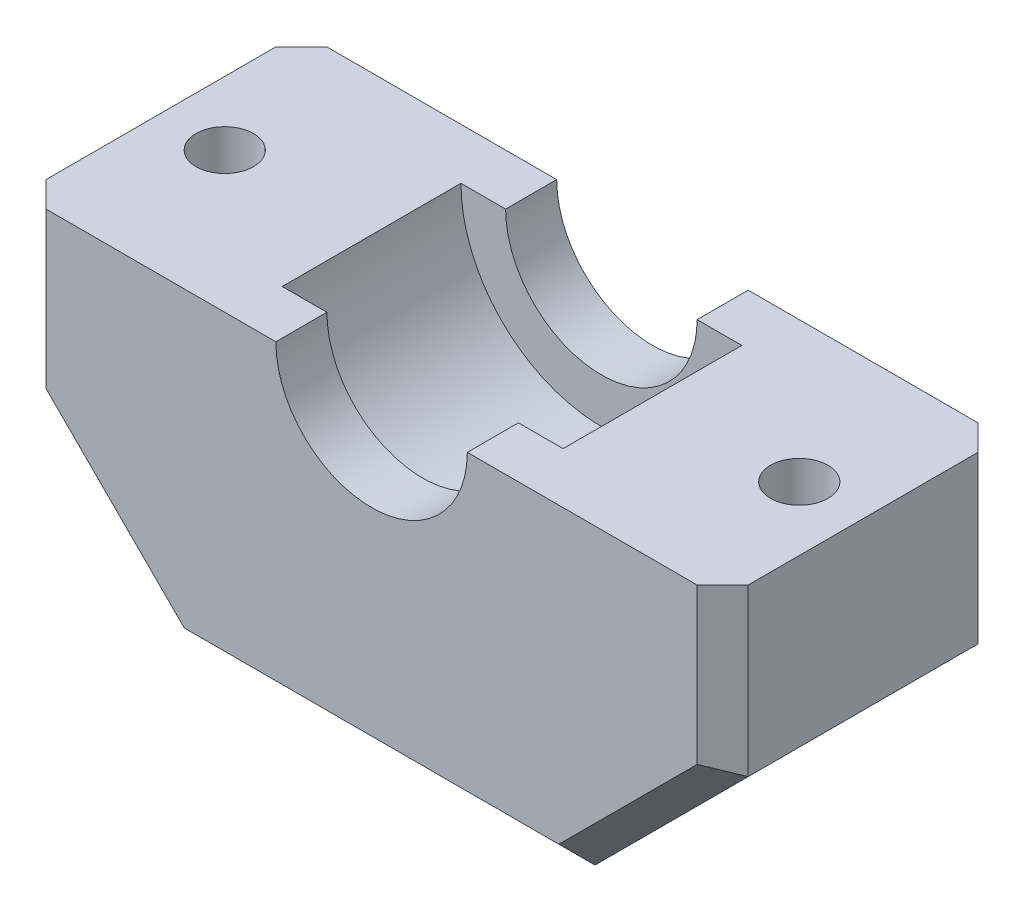
from build123d import *

# Parameters (mm, degrees)
BOSS_EXTRUDE1_DEPTH = 22
CHAMFER1_SIZE       = 12
SKETCH2_R           = 2.25
CUT_EXTRUDE1_DEPTH  = 25
SKETCH2_4_R         = 4.5
SKETCH2_4_R_2       = 2.25
CUT_EXTRUDE2_DEPTH  = 21
CHAMFER2_SIZE       = 2
BOSS_EXTRUDE2_START = -22
BOSS_EXTRUDE2_DEPTH = 22
BOSS_EXTRUDE3_DEPTH = 4
BOSS_EXTRUDE4_START = -4
BOSS_EXTRUDE4_DEPTH = 4


with BuildPart() as part:
    # Sketch1 → Boss-Extrude1 (new body)
    with BuildSketch(Plane(origin=(0, 0, 0), x_dir=(1, 0, 0), z_dir=(0, 0, -1))):
        with BuildLine():
            Line((-38.985549133, -2.028901734), (-48.985549133, -2.028901734))
            Line((-48.985549133, -2.028901734), (-48.985549133, 22.971098266))
            Line((-48.985549133, 22.971098266), (6.014450867, 22.971098266))
            Line((6.014450867, 22.971098266), (6.014450867, -2.028901734))
            Line((6.014450867, -2.028901734), (-3.985549133, -2.028901734))
            ThreePointArc((-3.985549133, -2.028901734), (-21.485549133, 15.471098266), (-38.985549133, -2.028901734))
        make_face()
    extrude(amount=BOSS_EXTRUDE1_DEPTH)

    # Chamfer1
    chamfer1_edges = [part.edges().sort_by_distance(p)[0] for p in [
        (-48.985549133, -22.971098266, -11),
        (6.014450867, -22.971098266, -11),
    ]]
    chamfer(chamfer1_edges, length=CHAMFER1_SIZE)

    # Sketch2 → Cut-Extrude1 (cut)
    with BuildSketch(Plane(origin=(0, -22.971098266, 0), x_dir=(-1, 0, 0), z_dir=(0, -1, 0))):
        with Locations(Location((43.985549133, 11, 0), (0, 0, 180))):
            Circle(SKETCH2_R)
        with Locations((-1.014450867, 11)):
            Circle(SKETCH2_R)
    extrude(amount=-CUT_EXTRUDE1_DEPTH, mode=Mode.SUBTRACT)

    # Sketch2<4> → Cut-Extrude2 (cut)
    # profile 1 of 2: a face of its own
    with BuildSketch(Plane(origin=(0, -22.971098266, 0), x_dir=(-1, 0, 0), z_dir=(0, -1, 0))):
        with Locations(Location((43.985549133, 11, 0), (0, 0, 180))):
            Circle(SKETCH2_4_R)
        with Locations(Location((43.985549133, 11, 0), (0, 0, 180))):
            Circle(SKETCH2_4_R_2, mode=Mode.SUBTRACT)
    # profile 2 of 2: a face of its own
    with BuildSketch(Plane(origin=(0, -22.971098266, 0), x_dir=(-1, 0, 0), z_dir=(0, -1, 0))):
        with Locations((-1.014450867, 11)):
            Circle(SKETCH2_4_R)
        with Locations(Location((-1.014450867, 11, 0), (0, 0, 180))):
            Circle(SKETCH2_4_R_2, mode=Mode.SUBTRACT)
    extrude(amount=-CUT_EXTRUDE2_DEPTH, mode=Mode.SUBTRACT)

    # Chamfer2
    chamfer2_edges = [part.edges().sort_by_distance(p)[0] for p in [
        (6.014450867, -4.471098266, -22),
        (-21.485549133, -22.971098266, 0),
        (-21.485549133, -22.971098266, -22),
        (-48.985549133, -4.471098266, 0),
        (-42.985549133, -16.971098266, 0),
        (0.014450867, -16.971098266, 0),
        (-48.985549133, -4.471098266, -22),
        (-42.985549133, -16.971098266, -22),
        (0.014450867, -16.971098266, -22),
        (6.014450867, -4.471098266, 0),
    ]]
    chamfer(chamfer2_edges, length=CHAMFER2_SIZE)

    # Sketch3 → Boss-Extrude2 (add)
    with BuildSketch(Plane(origin=(0, 0, -22), x_dir=(-1, 0, 0), z_dir=(0, 0, -1)).offset(BOSS_EXTRUDE2_START)):
        with BuildLine():
            Line((3.985549133, 2.028901734), (10.485549133, 2.028901734))
            ThreePointArc((10.485549133, 2.028901734), (21.485549133, -8.971098266), (32.485549133, 2.028901734))
            Line((32.485549133, 2.028901734), (38.985549133, 2.028901734))
            ThreePointArc((38.985549133, 2.028901734), (21.485549133, -15.471098266), (3.985549133, 2.028901734))
        make_face()
    extrude(amount=BOSS_EXTRUDE2_DEPTH)

    # Sketch4 → Boss-Extrude3 (add)
    with BuildSketch(Plane.XY):
        with BuildLine():
            Line((-32.485549133, 2.028901734), (-28.985549133, 2.028901734))
            ThreePointArc((-28.985549133, 2.028901734), (-21.485549133, -5.471098266), (-13.985549133, 2.028901734))
            Line((-13.985549133, 2.028901734), (-10.485549133, 2.028901734))
            ThreePointArc((-10.485549133, 2.028901734), (-21.485549133, -8.971098266), (-32.485549133, 2.028901734))
        make_face()
    extrude(amount=-BOSS_EXTRUDE3_DEPTH)

    # Sketch5 → Boss-Extrude4 (add)
    with BuildSketch(Plane(origin=(0, 0, -22), x_dir=(-1, 0, 0), z_dir=(0, 0, -1)).offset(BOSS_EXTRUDE4_START)):
        with BuildLine():
            Line((10.485549133, 2.028901734), (13.985549133, 2.028901734))
            ThreePointArc((13.985549133, 2.028901734), (21.485549133, -5.471098266), (28.985549133, 2.028901734))
            Line((28.985549133, 2.028901734), (32.485549133, 2.028901734))
            ThreePointArc((32.485549133, 2.028901734), (21.485549133, -8.971098266), (10.485549133, 2.028901734))
        make_face()
    extrude(amount=BOSS_EXTRUDE4_DEPTH)


solid = part.part
